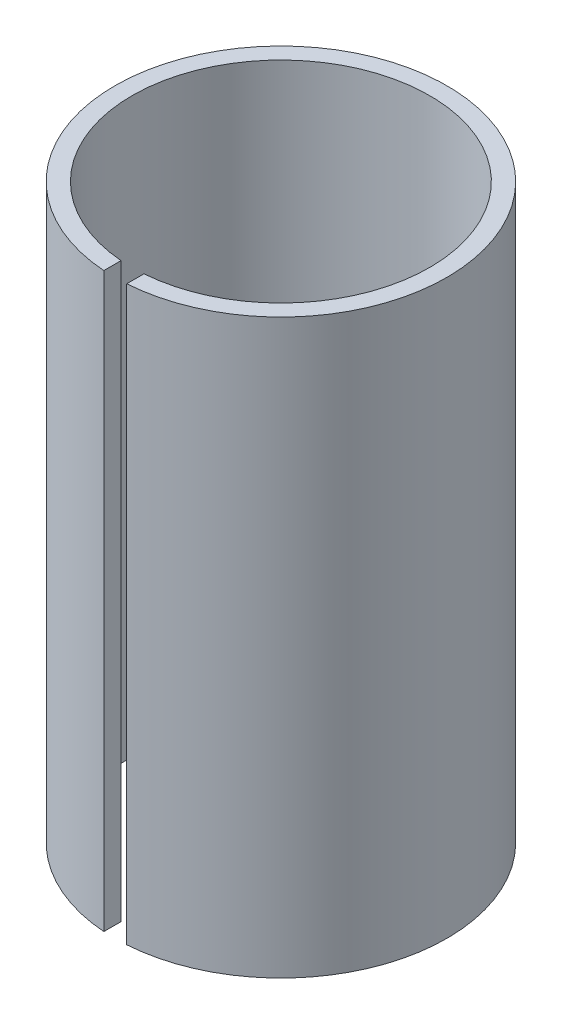
from build123d import *

# Parameters (mm, degrees)
BOSS_EXTRUDE1_DEPTH = 50


with BuildPart() as part:
    # Sketch1 → Boss-Extrude1 (new body)
    with BuildSketch(Plane(origin=(0, 0, 0), x_dir=(1, 0, 0), z_dir=(0, 1, 0))):
        with BuildLine():
            Line((-1, -14.465476141), (-1, -12.961481397))
            ThreePointArc((-1, -12.961481397), (-8.831760866, 9.539392014), (13, 0))
            ThreePointArc((13, 0), (9.539392014, -8.831760866), (1, -12.961481397))
            Line((1, -12.961481397), (1, -14.465476141))
            ThreePointArc((1, -14.465476141), (10.600707524, -9.893179469), (14.5, 0))
            ThreePointArc((14.5, 0), (-9.893179469, 10.600707524), (-1, -14.465476141))
        make_face()
    extrude(amount=BOSS_EXTRUDE1_DEPTH)


solid = part.part
